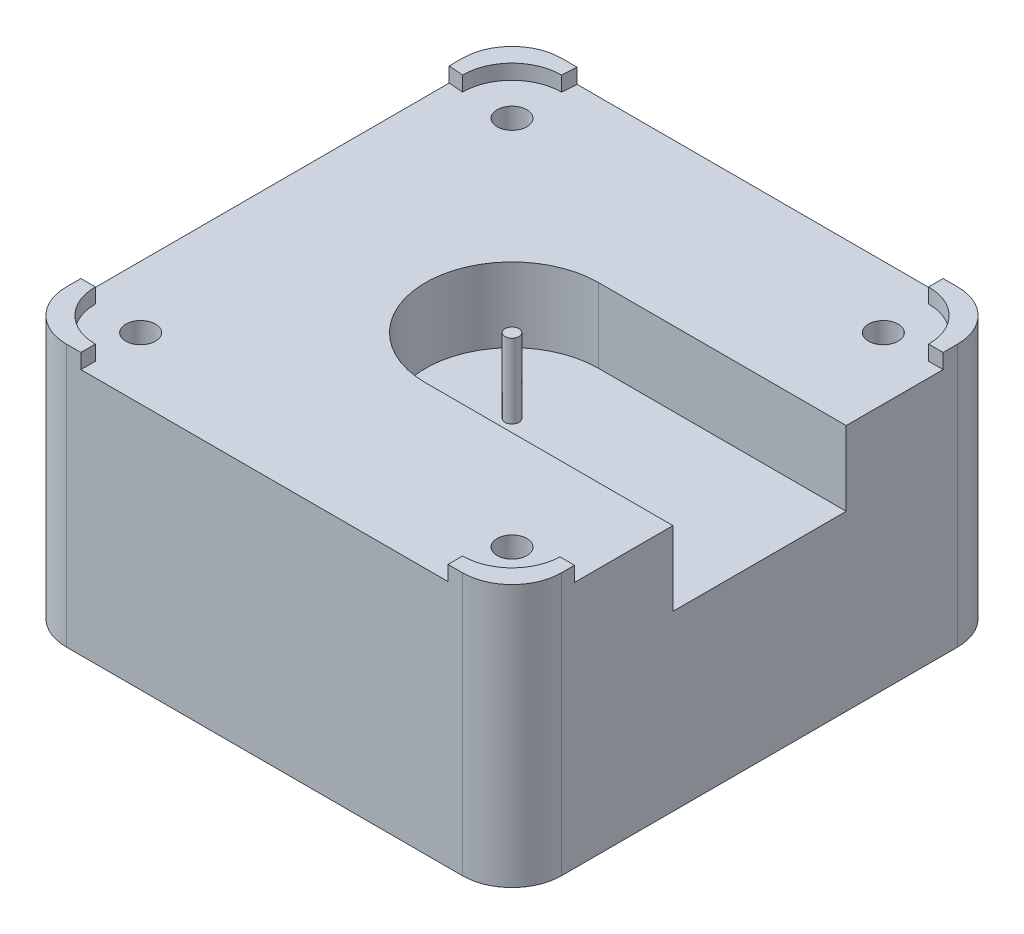
from build123d import *

# Parameters (mm, degrees)
SKETCH1_W           = 100
SKETCH1_H           = 100
BOSS_EXTRUDE1_DEPTH = 50
CUT_EXTRUDE1_DEPTH  = 12
SKETCH4_R           = 3
CUT_EXTRUDE2_DEPTH  = 100
CUT_EXTRUDE3_DEPTH  = 50
BOSS_EXTRUDE4_START = 3
BOSS_EXTRUDE4_DEPTH = 3
CUT_EXTRUDE4_DEPTH  = 15
SKETCH7_R           = 1.4
BOSS_EXTRUDE5_DEPTH = 15


with BuildPart() as part:
    # Sketch1 → Boss-Extrude1 (new body)
    with BuildSketch(Plane(origin=(0, 0, 0), x_dir=(1, 0, 0), z_dir=(0, 1, 0))):
        with Locations((1.40257771, -21.948445792)):
            Rectangle(SKETCH1_W, SKETCH1_H)
    extrude(amount=BOSS_EXTRUDE1_DEPTH)

    # Sketch2 → Cut-Extrude1 (cut)
    with BuildSketch(Plane(origin=(0, 50, 0), x_dir=(1, 0, 0), z_dir=(0, 1, 0))):
        with BuildLine():
            Line((1.40257771, -4.448445792), (51.40257771, -4.448445792))
            ThreePointArc((51.40257771, -4.448445792), (68.90257771, -21.948445792), (51.40257771, -39.448445792))
            Line((51.40257771, -39.448445792), (1.40257771, -39.448445792))
            ThreePointArc((1.40257771, -39.448445792), (-16.09742229, -21.948445792), (1.40257771, -4.448445792))
        make_face()
    extrude(amount=-CUT_EXTRUDE1_DEPTH, mode=Mode.SUBTRACT)

    # Sketch4 → Cut-Extrude2 (cut)
    with BuildSketch(Plane(origin=(0, 50, 0), x_dir=(1, 0, 0), z_dir=(0, 1, 0))):
        with Locations((38.90257771, 15.551554208)):
            Circle(SKETCH4_R)
        with Locations((-36.09742229, 15.551554208)):
            Circle(SKETCH4_R)
        with Locations((-36.09742229, -59.448445792)):
            Circle(SKETCH4_R)
        with Locations((38.90257771, -59.448445792)):
            Circle(SKETCH4_R)
    extrude(amount=-CUT_EXTRUDE2_DEPTH, mode=Mode.SUBTRACT)

    # Sketch5 → Cut-Extrude3 (cut)
    with BuildSketch(Plane(origin=(0, 50, 0), x_dir=(1, 0, 0), z_dir=(0, 1, 0))):
        with BuildLine():
            Line((-48.59742229, -61.948445792), (-48.59742229, -71.948445792))
            Line((-48.59742229, -71.948445792), (-38.59742229, -71.948445792))
            ThreePointArc((-38.59742229, -71.948445792), (-45.668490101, -69.019513604), (-48.59742229, -61.948445792))
        make_face()
        with BuildLine():
            Line((-48.59742229, 28.051554208), (-38.59742229, 28.051554208))
            ThreePointArc((-38.59742229, 28.051554208), (-45.668490101, 25.12262202), (-48.59742229, 18.051554208))
            Line((-48.59742229, 18.051554208), (-48.59742229, 28.051554208))
        make_face()
        with BuildLine():
            Line((51.40257771, 28.051554208), (51.40257771, 18.051554208))
            ThreePointArc((51.40257771, 18.051554208), (48.473645522, 25.12262202), (41.40257771, 28.051554208))
            Line((41.40257771, 28.051554208), (51.40257771, 28.051554208))
        make_face()
        with BuildLine():
            Line((51.40257771, -61.948445792), (51.40257771, -71.948445792))
            Line((51.40257771, -71.948445792), (41.40257771, -71.948445792))
            ThreePointArc((41.40257771, -71.948445792), (48.473645522, -69.019513604), (51.40257771, -61.948445792))
        make_face()
    extrude(amount=-CUT_EXTRUDE3_DEPTH, mode=Mode.SUBTRACT)

    # Sketch6 → Boss-Extrude4 (add)
    with BuildSketch(Plane(origin=(0, 50, 0), x_dir=(1, 0, 0), z_dir=(0, 1, 0)).offset(BOSS_EXTRUDE4_START)):
        with BuildLine():
            ThreePointArc((38.473645522, 25.12262202), (45.544713334, 22.193689831), (48.473645522, 15.12262202))
            Line((48.473645522, 15.12262202), (51.40257771, 15.12262202))
            Line((51.40257771, 15.12262202), (51.40257771, 18.051554208))
            ThreePointArc((51.40257771, 18.051554208), (48.473645522, 25.12262202), (41.40257771, 28.051554208))
            Line((41.40257771, 28.051554208), (38.473645522, 28.051554208))
            Line((38.473645522, 28.051554208), (38.473645522, 25.12262202))
        make_face()
        with BuildLine():
            Line((-45.668490101, -59.019513604), (-48.59742229, -59.019513604))
            Line((-48.59742229, -59.019513604), (-48.59742229, -61.948445792))
            ThreePointArc((-48.59742229, -61.948445792), (-45.668490101, -69.019513604), (-38.59742229, -71.948445792))
            Line((-38.59742229, -71.948445792), (-35.668490101, -71.948445792))
            Line((-35.668490101, -71.948445792), (-35.668490101, -69.019513604))
            ThreePointArc((-35.668490101, -69.019513604), (-42.739557913, -66.090581416), (-45.668490101, -59.019513604))
        make_face()
        with BuildLine():
            Line((-35.668490101, 25.12262202), (-35.440476138, 28.051554208))
            Line((-35.440476138, 28.051554208), (-38.59742229, 28.051554208))
            ThreePointArc((-38.59742229, 28.051554208), (-45.668490101, 25.12262202), (-48.59742229, 18.051554208))
            Line((-48.59742229, 18.051554208), (-48.59742229, 15.374965532))
            Line((-48.59742229, 15.374965532), (-45.668490101, 15.12262202))
            ThreePointArc((-45.668490101, 15.12262202), (-42.739557913, 22.193689831), (-35.668490101, 25.12262202))
        make_face()
        with BuildLine():
            Line((51.40257771, -59.325952065), (48.468949193, -59.325952065))
            ThreePointArc((48.468949193, -59.325952065), (45.435528005, -66.198106245), (38.473645522, -69.019513604))
            Line((38.473645522, -69.019513604), (38.473645522, -71.948445792))
            Line((38.473645522, -71.948445792), (41.40257771, -71.948445792))
            ThreePointArc((41.40257771, -71.948445792), (48.473645522, -69.019513604), (51.40257771, -61.948445792))
            Line((51.40257771, -61.948445792), (51.40257771, -59.325952065))
        make_face()
    extrude(amount=-BOSS_EXTRUDE4_DEPTH)

    # Sketch2<2> → Cut-Extrude4 (cut)
    with BuildSketch(Plane(origin=(0, 50, 0), x_dir=(1, 0, 0), z_dir=(0, 1, 0))):
        with BuildLine():
            Line((1.40257771, -4.448445792), (51.40257771, -4.448445792))
            ThreePointArc((51.40257771, -4.448445792), (68.90257771, -21.948445792), (51.40257771, -39.448445792))
            Line((51.40257771, -39.448445792), (1.40257771, -39.448445792))
            ThreePointArc((1.40257771, -39.448445792), (-16.09742229, -21.948445792), (1.40257771, -4.448445792))
        make_face()
    extrude(amount=-CUT_EXTRUDE4_DEPTH, mode=Mode.SUBTRACT)

    # Sketch7 → Boss-Extrude5 (add)
    with BuildSketch(Plane(origin=(0, 35, 0), x_dir=(1, 0, 0), z_dir=(0, 1, 0))):
        with Locations((1.40257771, -21.948445792)):
            Circle(SKETCH7_R)
    extrude(amount=BOSS_EXTRUDE5_DEPTH)


solid = part.part
